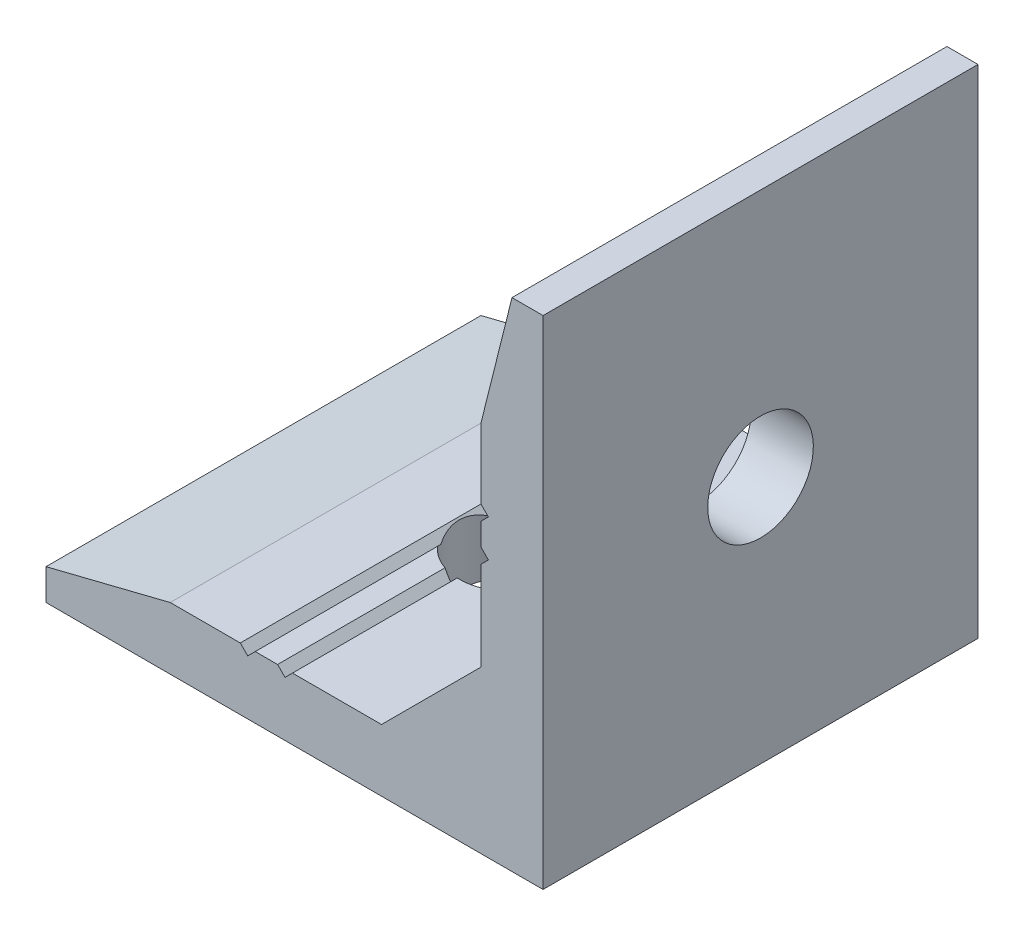
from build123d import *

# Parameters (mm, degrees)
EXTRUDE_1_DEPTH     = 17.5
SKETCH_3_R          = 4.25
CUT_EXTRUDE_1_DEPTH = 56.957573214
SKETCH_4_R          = 4.25
CUT_EXTRUDE_2_DEPTH = 56.957573214


with BuildPart() as part:
    # 草图1 → 凸台-拉伸1 (new, symmetric)
    with BuildSketch(Plane.XY):
        Polygon((0, 0), (40, 0), (40, 40), (37.5, 40), (35, 30), (35, 24.364950833), (35.6, 23.764950833), (35, 23.164950833), (35, 21.364950833), (35.6, 20.764950833), (35, 20.164950833), (35, 13), (27, 5), (19.835049167, 5), (19.235049167, 4.4), (18.635049167, 5), (16.835049167, 5), (16.235049167, 4.4), (15.635049167, 5), (10, 5), (0, 2.5), align=None)
    extrude(amount=EXTRUDE_1_DEPTH, both=True)

    # 草图3 → 切除-拉伸1 (cut, through all)
    with BuildSketch(Plane(origin=(0, 5, 0), x_dir=(1, 0, 0), z_dir=(0, 1, 0))):
        with Locations(Location((20, 0, 0), (0, 0, 270))):
            Circle(SKETCH_3_R)
    extrude(amount=-CUT_EXTRUDE_1_DEPTH, mode=Mode.SUBTRACT)

    # 草图4 → 切除-拉伸2 (cut, through all)
    with BuildSketch(Plane.ZY.offset(-35)):
        with Locations(Location((0, 20, 0), (0, 0, 270))):
            Circle(SKETCH_4_R)
    extrude(amount=-CUT_EXTRUDE_2_DEPTH, mode=Mode.SUBTRACT)


solid = part.part
